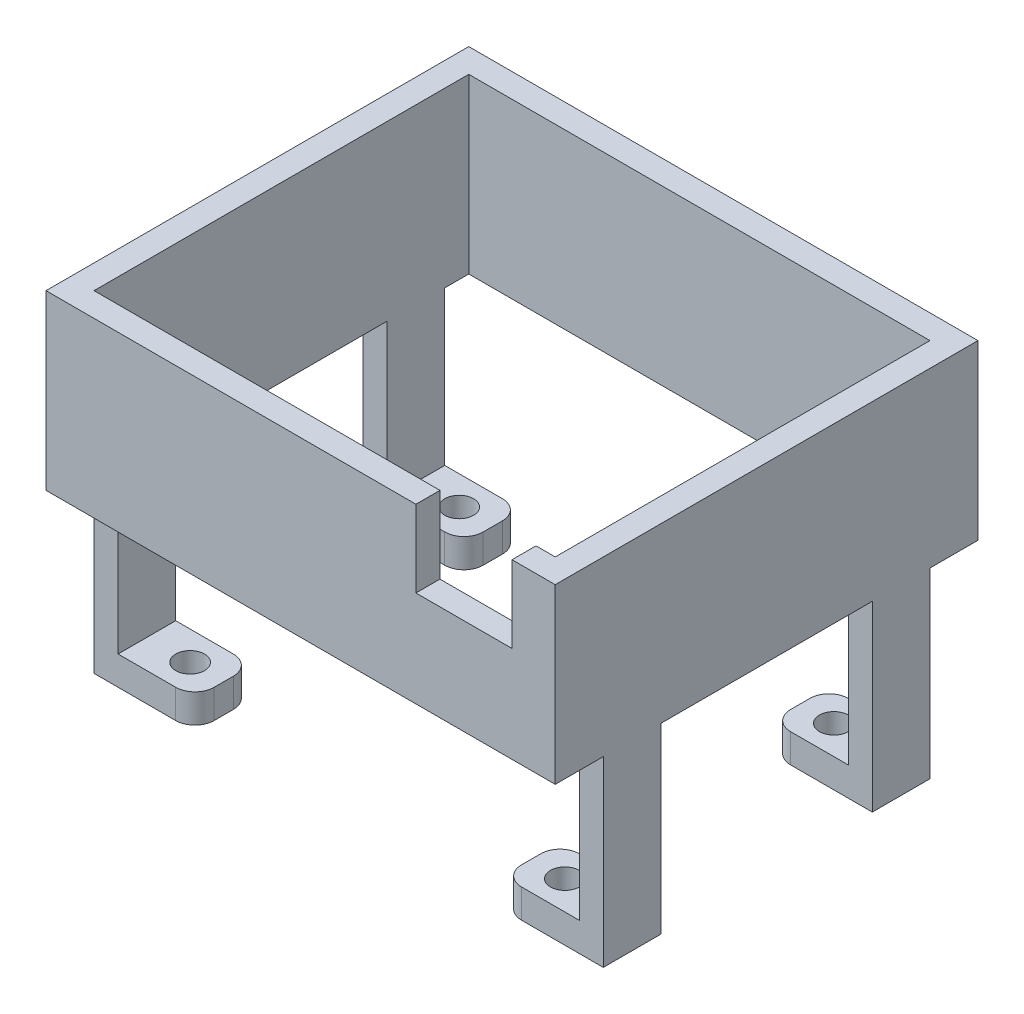
from build123d import *

# Parameters (mm, degrees)
SKETCH_1_W          = 53
SKETCH_1_H          = 44
SKETCH_1_W_2        = 48
SKETCH_1_H_2        = 39
EXTRUDE_1_DEPTH     = 18
SKETCH_2_W          = 2.5
SKETCH_2_H          = 6
EXTRUDE_2_DEPTH     = 16
SKETCH_3_W          = 8
SKETCH_3_H          = 6
SKETCH_3_R          = 1.5
SKETCH_3_W_2        = 2.5
EXTRUDE_3_DEPTH     = 3
FILLET_1_R          = 2
SKETCH_4_W          = 10
SKETCH_4_H          = 8
CUT_EXTRUDE_1_DEPTH = 5


with BuildPart() as part:
    # 草图1 → 凸台-拉伸1 (new body)
    with BuildSketch(Plane(origin=(0, 0, 0), x_dir=(1, 0, 0), z_dir=(0, 1, 0))):
        Rectangle(SKETCH_1_W, SKETCH_1_H)
        Rectangle(SKETCH_1_W_2, SKETCH_1_H_2, mode=Mode.SUBTRACT)
    extrude(amount=EXTRUDE_1_DEPTH)

    # 草图2 → 凸台-拉伸2 (add)
    with BuildSketch(Plane.XZ):
        with Locations((25.25, 14)):
            Rectangle(SKETCH_2_W, SKETCH_2_H)
        with Locations((25.25, -14)):
            Rectangle(SKETCH_2_W, SKETCH_2_H)
        with Locations((-25.25, -14)):
            Rectangle(SKETCH_2_W, SKETCH_2_H)
        with Locations((-25.25, 14)):
            Rectangle(SKETCH_2_W, SKETCH_2_H)
    extrude(amount=EXTRUDE_2_DEPTH)

    # 草图3 → 凸台-拉伸3 (add)
    # profile 1 of 8: a face of its own
    with BuildSketch(Plane.XZ.offset(16)):
        with Locations((-20, 14)):
            Rectangle(SKETCH_3_W, SKETCH_3_H)
        with Locations(Location((-19.5, 14, 0), (0, 0, 270))):
            Circle(SKETCH_3_R, mode=Mode.SUBTRACT)
    # profile 2 of 8: a face of its own
    with BuildSketch(Plane.XZ.offset(16)):
        with Locations((-25.25, 14)):
            Rectangle(SKETCH_3_W_2, SKETCH_3_H)
    # profile 3 of 8: a face of its own
    with BuildSketch(Plane.XZ.offset(16)):
        with Locations((25.25, 14)):
            Rectangle(SKETCH_3_W_2, SKETCH_3_H)
    # profile 4 of 8: a face of its own
    with BuildSketch(Plane.XZ.offset(16)):
        with Locations((20, 14)):
            Rectangle(SKETCH_3_W, SKETCH_3_H)
        with Locations(Location((19.5, 14, 0), (0, 0, 270))):
            Circle(SKETCH_3_R, mode=Mode.SUBTRACT)
    # profile 5 of 8: a face of its own
    with BuildSketch(Plane.XZ.offset(16)):
        with Locations((20, -14)):
            Rectangle(SKETCH_3_W, SKETCH_3_H)
        with Locations(Location((19.5, -14, 0), (0, 0, 270))):
            Circle(SKETCH_3_R, mode=Mode.SUBTRACT)
    # profile 6 of 8: a face of its own
    with BuildSketch(Plane.XZ.offset(16)):
        with Locations((25.25, -14)):
            Rectangle(SKETCH_3_W_2, SKETCH_3_H)
    # profile 7 of 8: a face of its own
    with BuildSketch(Plane.XZ.offset(16)):
        with Locations((-25.25, -14)):
            Rectangle(SKETCH_3_W_2, SKETCH_3_H)
    # profile 8 of 8: a face of its own
    with BuildSketch(Plane.XZ.offset(16)):
        with Locations((-20, -14)):
            Rectangle(SKETCH_3_W, SKETCH_3_H)
        with Locations(Location((-19.5, -14, 0), (0, 0, 270))):
            Circle(SKETCH_3_R, mode=Mode.SUBTRACT)
    extrude(amount=EXTRUDE_3_DEPTH)

    # 圆角1
    fillet_1_edges = [part.edges().sort_by_distance(p)[0] for p in [
        (16, -17.5, -17),
        (16, -17.5, -11),
        (-16, -17.5, -17),
        (-16, -17.5, -11),
        (-16, -17.5, 17),
        (-16, -17.5, 11),
        (16, -17.5, 17),
        (16, -17.5, 11),
    ]]
    fillet(fillet_1_edges, radius=FILLET_1_R)

    # 草图4 → 切除-拉伸1 (cut)
    with BuildSketch(Plane.XY.offset(22)):
        with Locations((17, 14)):
            Rectangle(SKETCH_4_W, SKETCH_4_H)
    extrude(amount=-CUT_EXTRUDE_1_DEPTH, mode=Mode.SUBTRACT)


solid = part.part
